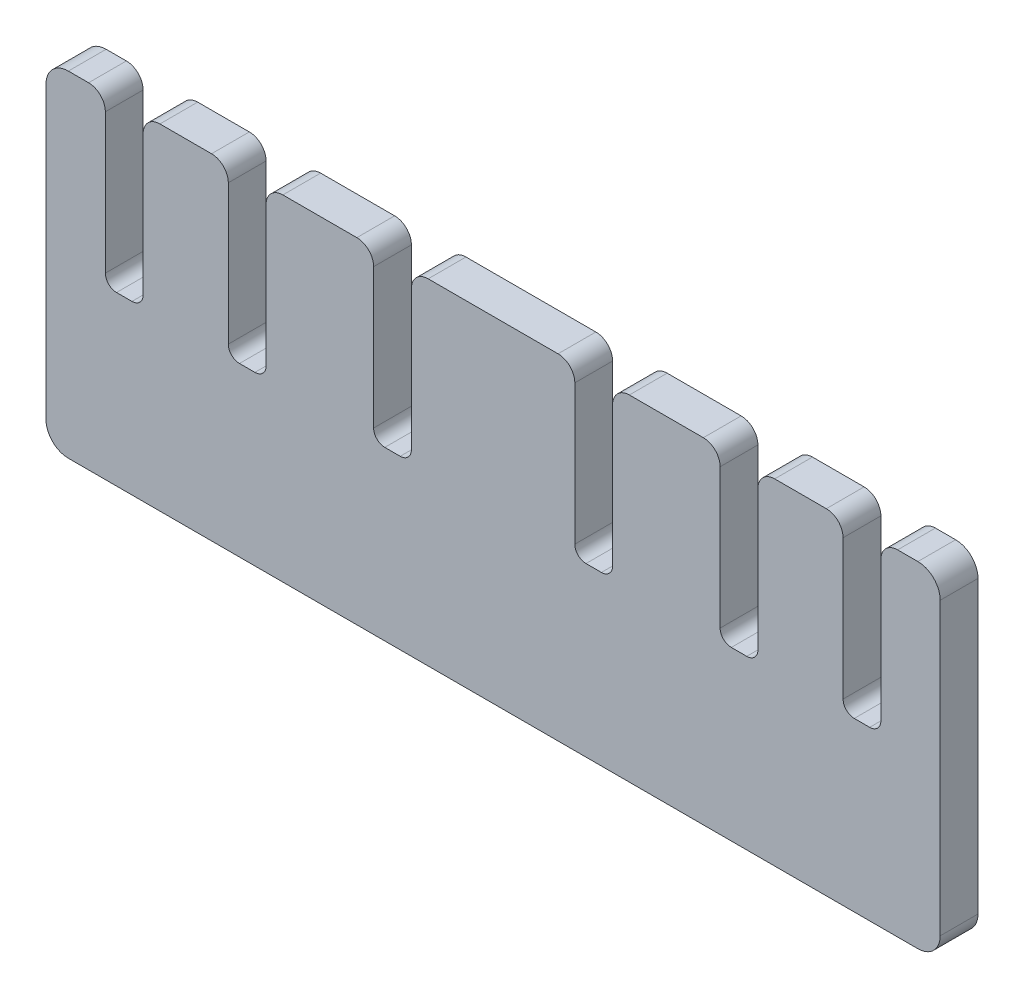
from build123d import *

# Parameters (mm, degrees)
SKETCH1_W           = 101.6
SKETCH1_H           = 38.1
BOSS_EXTRUDE1_DEPTH = 4.2926
FILLET1_R           = 2.54
SKETCH2_W           = 4.2926
SKETCH2_H           = 19.05
CUT_EXTRUDE1_DEPTH  = 4.2926
FILLET2_R           = 1.905
FILLET3_R           = 1.27


with BuildPart() as part:
    # Sketch1 → Boss-Extrude1 (new body)
    with BuildSketch(Plane.XY):
        Rectangle(SKETCH1_W, SKETCH1_H)
    extrude(amount=BOSS_EXTRUDE1_DEPTH)

    # Fillet1
    fillet1_edges = [part.edges().sort_by_distance(p)[0] for p in [
        (50.8, -19.05, 2.1463),
        (-50.8, -19.05, 2.1463),
        (-50.8, 19.05, 2.1463),
        (50.8, 19.05, 2.1463),
    ]]
    fillet(fillet1_edges, radius=FILLET1_R)

    # Sketch2 → Cut-Extrude1 (cut)
    with BuildSketch(Plane.XY.offset(4.2926)):
        with Locations((-41.91, 9.525)):
            Rectangle(SKETCH2_W, SKETCH2_H)
        with Locations((-27.94, 9.525)):
            Rectangle(SKETCH2_W, SKETCH2_H)
        with Locations((-11.43, 9.525)):
            Rectangle(SKETCH2_W, SKETCH2_H)
        with Locations((11.43, 9.525)):
            Rectangle(SKETCH2_W, SKETCH2_H)
        with Locations((27.94, 9.525)):
            Rectangle(SKETCH2_W, SKETCH2_H)
        with Locations((41.91, 9.525)):
            Rectangle(SKETCH2_W, SKETCH2_H)
    extrude(amount=-CUT_EXTRUDE1_DEPTH, mode=Mode.SUBTRACT)

    # Fillet2
    fillet2_edges = [part.edges().sort_by_distance(p)[0] for p in [
        (-39.7637, 19.05, 2.1463),
        (-44.0563, 19.05, 2.1463),
        (-25.7937, 19.05, 2.1463),
        (-30.0863, 19.05, 2.1463),
        (-9.2837, 19.05, 2.1463),
        (-13.5763, 19.05, 2.1463),
        (13.5763, 19.05, 2.1463),
        (9.2837, 19.05, 2.1463),
        (30.0863, 19.05, 2.1463),
        (25.7937, 19.05, 2.1463),
        (44.0563, 19.05, 2.1463),
        (39.7637, 19.05, 2.1463),
    ]]
    fillet(fillet2_edges, radius=FILLET2_R)

    # Fillet3
    fillet3_edges = [part.edges().sort_by_distance(p)[0] for p in [
        (-39.7637, 0, 2.1463),
        (-44.0563, 0, 2.1463),
        (-25.7937, 0, 2.1463),
        (-30.0863, 0, 2.1463),
        (-9.2837, 0, 2.1463),
        (-13.5763, 0, 2.1463),
        (13.5763, 0, 2.1463),
        (9.2837, 0, 2.1463),
        (30.0863, 0, 2.1463),
        (25.7937, 0, 2.1463),
        (44.0563, 0, 2.1463),
        (39.7637, 0, 2.1463),
    ]]
    fillet(fillet3_edges, radius=FILLET3_R)


solid = part.part
